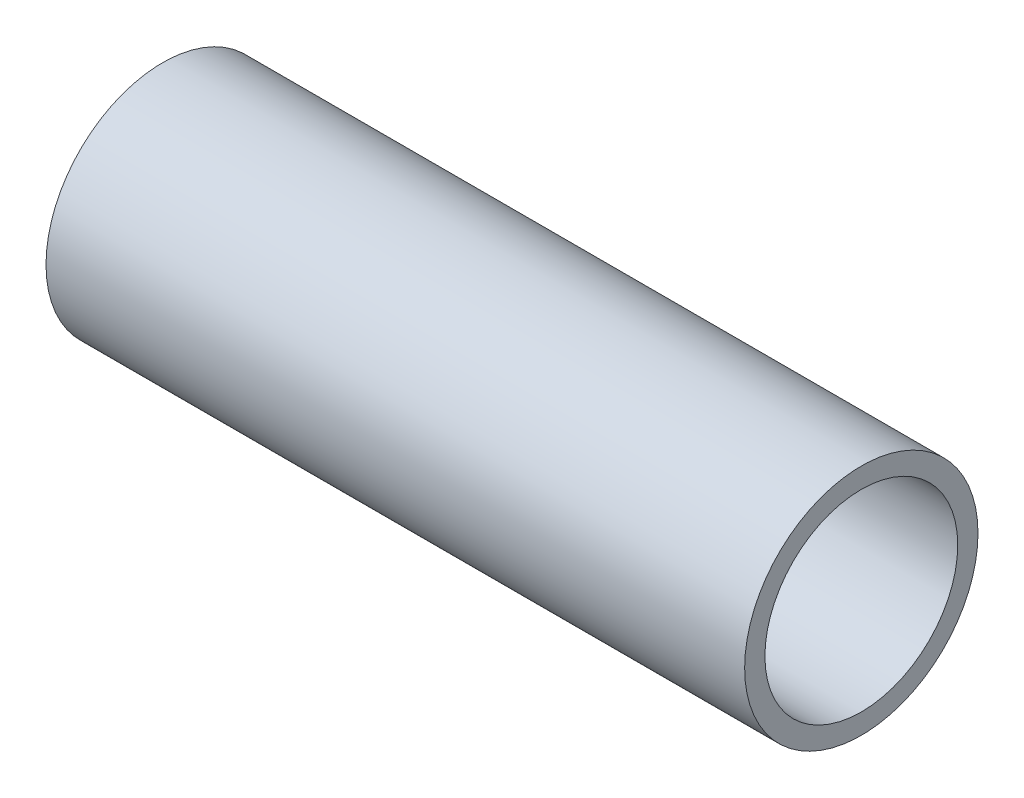
from build123d import *

# Parameters (mm, degrees)
SKETCH1_R           = 16.7
SKETCH1_R_2         = 13.8
BOSS_EXTRUDE1_DEPTH = 100


with BuildPart() as part:
    # Sketch1 → Boss-Extrude1 (new body)
    with BuildSketch(Plane(origin=(0, 0, 0), x_dir=(0, 0, -1), z_dir=(1, 0, 0))):
        Circle(SKETCH1_R)
        Circle(SKETCH1_R_2, mode=Mode.SUBTRACT)
    extrude(amount=BOSS_EXTRUDE1_DEPTH)


solid = part.part
